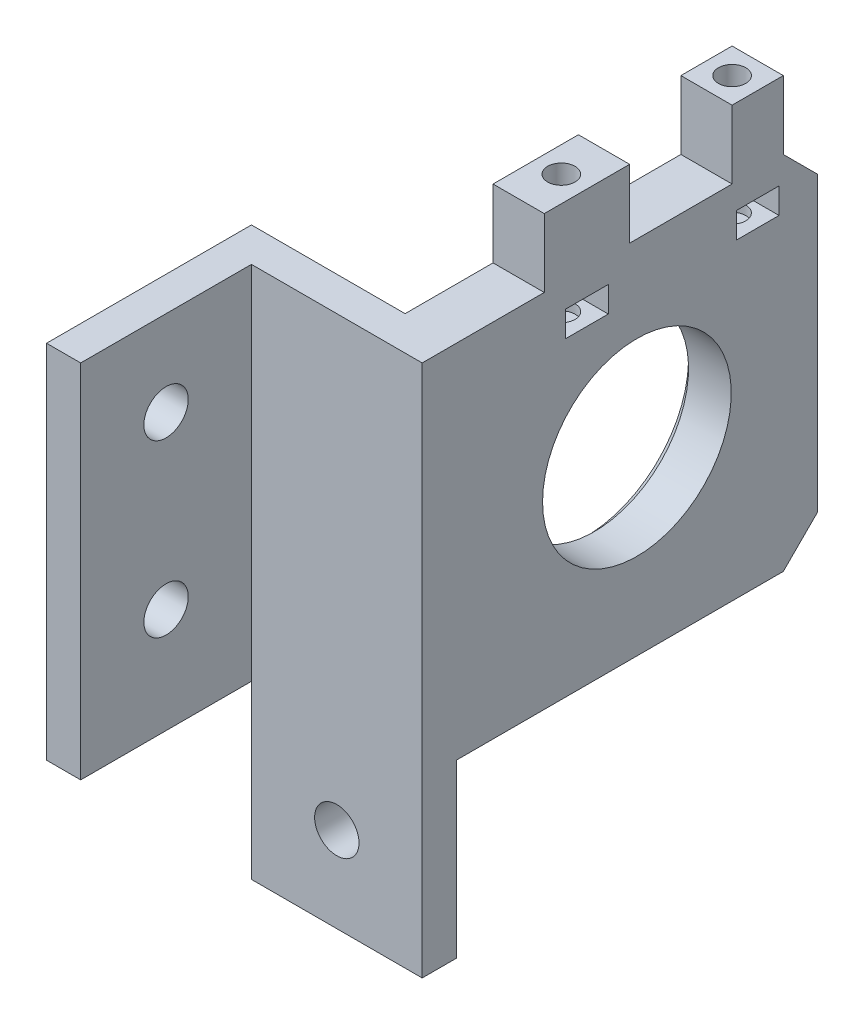
from build123d import *

# Parameters (mm, degrees)
SKICA2_W                 = 20
SKICA2_H                 = 42.3
P_IDAT_VYSUNUT_M1_DEPTH  = 4
SKICA3_W                 = 24
SKICA3_H                 = 42.3
P_IDAT_VYSUNUT_M2_DEPTH  = 4
SKICA4_W                 = 6
SKICA4_H                 = 42.3
P_IDAT_VYSUNUT_M3_DEPTH  = 42.3
SKICA5_R                 = 11.05
ODEBRAT_VYSUNUT_M1_DEPTH = 7
SKICA7_R                 = 2.6
ODEBRAT_VYSUNUT_M3_DEPTH = 4
ZKOSEN_1_SIZE            = 1
SKICA8_W                 = 20
SKICA8_H                 = 4
P_IDAT_VYSUNUT_M4_DEPTH  = 20.091596743
SKICA9_R                 = 2.6
ODEBRAT_VYSUNUT_M4_DEPTH = 4
ODEBRAT_VYSUNUT_M5_DEPTH = 80
SKICA11_W                = 84.692176523
SKICA11_H                = 80.474242756
ODEBRAT_VYSUNUT_M6_DEPTH = 24
SKICA12_W                = 6
SKICA12_H                = 6
SKICA12_H_2              = 10
P_IDAT_VYSUNUT_M5_DEPTH  = 8
SKICA13_R                = 1.6
ODEBRAT_VYSUNUT_M7_DEPTH = 15
SKICA14_W                = 5
SKICA14_H                = 3
ODEBRAT_VYSUNUT_M8_DEPTH = 15


with BuildPart() as part:
    # Skica2 → Přidat vysunutím1 (new body)
    with BuildSketch(Plane.XY):
        with Locations((-14.524287798, -61.15)):
            Rectangle(SKICA2_W, SKICA2_H)
    extrude(amount=P_IDAT_VYSUNUT_M1_DEPTH)

    # Skica3 → Přidat vysunutím2 (add)
    with BuildSketch(Plane.ZY.offset(24.524287798)):
        with Locations((-8, -61.15)):
            Rectangle(SKICA3_W, SKICA3_H)
    extrude(amount=P_IDAT_VYSUNUT_M2_DEPTH)

    # Skica4 → Přidat vysunutím3 (add)
    with BuildSketch(Plane.XY.offset(4)):
        with Locations((-7.524287798, -61.15)):
            Rectangle(SKICA4_W, SKICA4_H)
    extrude(amount=P_IDAT_VYSUNUT_M3_DEPTH)

    # Skica5 → Odebrat vysunutím1 (cut)
    with BuildSketch(Plane(origin=(-4.524287798, 0, 0), x_dir=(0, 0, -1), z_dir=(1, 0, 0))):
        with Locations((-25.15, -61.15)):
            Circle(SKICA5_R)
    extrude(amount=-ODEBRAT_VYSUNUT_M1_DEPTH, mode=Mode.SUBTRACT)

    # Skica7 → Odebrat vysunutím3 (cut)
    with BuildSketch(Plane.ZY.offset(28.524287798)):
        with Locations(Location((-10, -50, 0), (0, 0, 270))):
            Circle(SKICA7_R)
        with Locations(Location((-10, -70, 0), (0, 0, 270))):
            Circle(SKICA7_R)
    extrude(amount=-ODEBRAT_VYSUNUT_M3_DEPTH, mode=Mode.SUBTRACT)

    # Zkosení1
    zkosen_1_edges = [part.edges().sort_by_distance(p)[0] for p in [
        (-10.524287798, -61.15, 36.2),
    ]]
    chamfer(zkosen_1_edges, length=ZKOSEN_1_SIZE)

    # Skica8 → Přidat vysunutím4 (add)
    with BuildSketch(Plane.XZ.offset(82.3)):
        with Locations((-14.524287798, 2)):
            Rectangle(SKICA8_W, SKICA8_H)
    extrude(amount=P_IDAT_VYSUNUT_M4_DEPTH)

    # Skica9 → Odebrat vysunutím4 (cut)
    with BuildSketch(Plane.XY.offset(4)):
        with Locations((-14.524287798, -92.391596743)):
            Circle(SKICA9_R)
    extrude(amount=-ODEBRAT_VYSUNUT_M4_DEPTH, mode=Mode.SUBTRACT)

    # Skica10 → Odebrat vysunutím5 (cut)
    with BuildSketch(Plane.ZY.offset(10.524287798)):
        Polygon((46.3, -44), (42.3, -40), (46.565878614, -39.259270079), align=None)
        Polygon((42.3, -82.3), (46.3, -78.3), (47.745576453, -80.3), (46.3, -85.415433185), align=None)
    extrude(amount=-ODEBRAT_VYSUNUT_M5_DEPTH, mode=Mode.SUBTRACT)


with BuildPart() as body_2:
    # Zrcadlit1: mirrored copy
    add(part.part.mirror(Plane(origin=(-28.524287798, -40, -20), x_dir=(1, 0, 0), z_dir=(0, 0, 1))))

    # Skica12 → Přidat vysunutím5 (add)
    with BuildSketch(Plane(origin=(0, -40, 0), x_dir=(1, 0, 0), z_dir=(0, 1, 0))):
        with Locations((-7.524287798, 79.3)):
            Rectangle(SKICA12_W, SKICA12_H)
        with Locations((-7.524287798, 59.3)):
            Rectangle(SKICA12_W, SKICA12_H_2)
    extrude(amount=P_IDAT_VYSUNUT_M5_DEPTH)

    # Skica13 → Odebrat vysunutím7 (cut)
    with BuildSketch(Plane(origin=(0, -32, 0), x_dir=(1, 0, 0), z_dir=(0, 1, 0))):
        with Locations(Location((-7.524287798, 59.3, 0), (0, 0, 270))):
            Circle(SKICA13_R)
        with Locations(Location((-7.524287798, 79.3, 0), (0, 0, 270))):
            Circle(SKICA13_R)
    extrude(amount=-ODEBRAT_VYSUNUT_M7_DEPTH, mode=Mode.SUBTRACT)

    # Skica14 → Odebrat vysunutím8 (cut)
    with BuildSketch(Plane(origin=(-4.524287798, 0, 0), x_dir=(0, 0, -1), z_dir=(1, 0, 0))):
        with Locations((59.3, -44.438988808)):
            Rectangle(SKICA14_W, SKICA14_H)
        with Locations((79.3, -44.438988808)):
            Rectangle(SKICA14_W, SKICA14_H)
    extrude(amount=-ODEBRAT_VYSUNUT_M8_DEPTH, mode=Mode.SUBTRACT)


with BuildPart() as part_1:
    add(part.part)

    # Skica11 → Odebrat vysunutím6 (cut)
    with BuildSketch(Plane.ZY.offset(28.524287798)):
        with Locations((22.346088262, -80.237121378)):
            Rectangle(SKICA11_W, SKICA11_H)
    extrude(amount=-ODEBRAT_VYSUNUT_M6_DEPTH, mode=Mode.SUBTRACT)


solid = body_2.part
